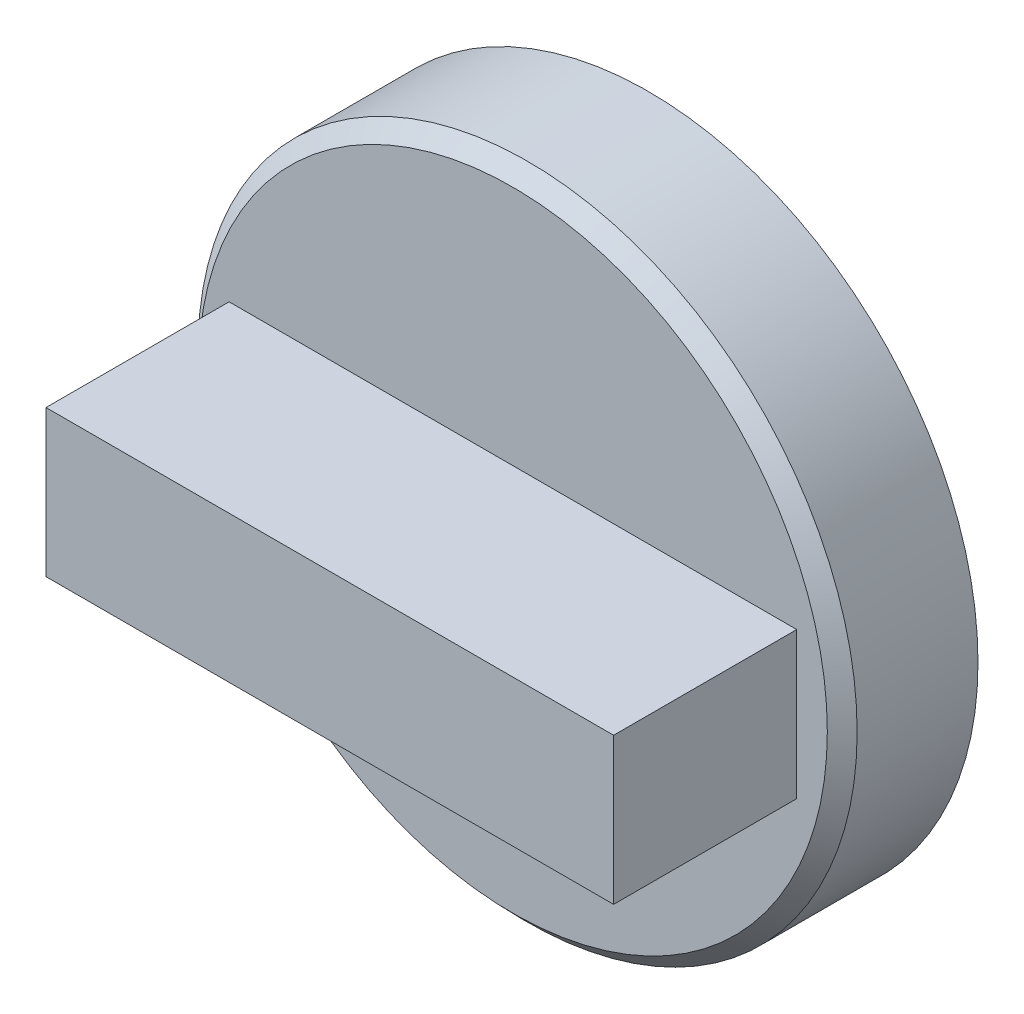
from build123d import *

# Parameters (mm, degrees)
SKETCH3_R           = 90
BOSS_EXTRUDE1_DEPTH = 37
CHAMFER1_SIZE       = 4
CHAMFER1_SIZE2      = 4.142121255
SKETCH4_W           = 155
SKETCH4_H           = 40
BOSS_EXTRUDE2_DEPTH = 50


with BuildPart() as part:
    # Sketch3 → Boss-Extrude1 (new body)
    with BuildSketch(Plane.XY):
        Circle(SKETCH3_R)
    extrude(amount=BOSS_EXTRUDE1_DEPTH)

    # Chamfer1
    chamfer1_edges = [part.edges().sort_by_distance(p)[0] for p in [
        (-90, 0, 37),
    ]]
    chamfer1_side = [part.faces().sort_by_distance(p)[0] for p in [
        (-90, 0, 18.5),
    ]]
    chamfer(chamfer1_edges, length=CHAMFER1_SIZE, length2=CHAMFER1_SIZE2, reference=chamfer1_side[0])

    # Sketch4 → Boss-Extrude2 (add)
    with BuildSketch(Plane.XY.offset(37)):
        Rectangle(SKETCH4_W, SKETCH4_H)
    extrude(amount=BOSS_EXTRUDE2_DEPTH)


solid = part.part
